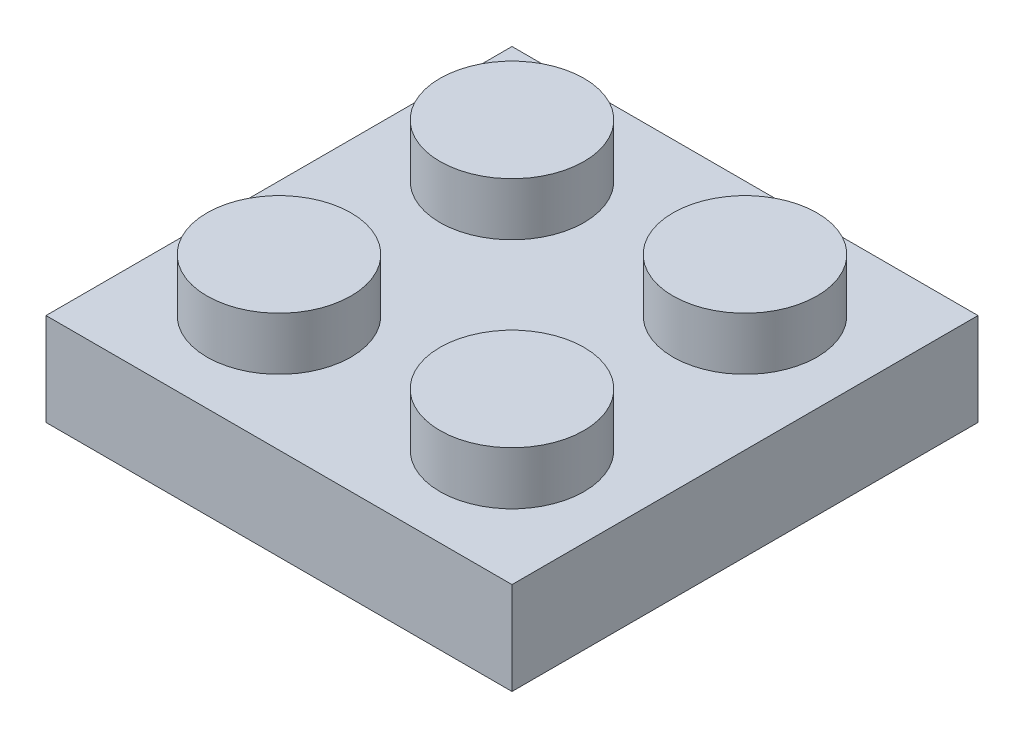
from build123d import *

# Parameters (mm, degrees)
SKETCH1_W           = 15.85
SKETCH1_H           = 15.85
BOSS_EXTRUDE1_DEPTH = 3.15
SKETCH2_R           = 2.45
BOSS_EXTRUDE2_DEPTH = 1.8
SHELL1_T            = -1.5
SKETCH3_R           = 3.25
SKETCH3_R_2         = 2.45
BOSS_EXTRUDE3_DEPTH = 1.45


with BuildPart() as part:
    # Sketch1 → Boss-Extrude1 (new body)
    with BuildSketch(Plane(origin=(0, 0, 0), x_dir=(1, 0, 0), z_dir=(0, 1, 0))):
        Rectangle(SKETCH1_W, SKETCH1_H)
    extrude(amount=-BOSS_EXTRUDE1_DEPTH)

    # Sketch2 → Boss-Extrude2 (add)
    with BuildSketch(Plane(origin=(0, 0, 0), x_dir=(1, 0, 0), z_dir=(0, 1, 0))):
        with Locations(Location((-3.9625, 3.9625, 0), (0, 0, 270))):
            Circle(SKETCH2_R)
        with Locations(Location((-3.9625, -3.9625, 0), (0, 0, 270))):
            Circle(SKETCH2_R)
        with Locations(Location((3.9625, 3.9625, 0), (0, 0, 270))):
            Circle(SKETCH2_R)
        with Locations(Location((3.9625, -3.9625, 0), (0, 0, 270))):
            Circle(SKETCH2_R)
    extrude(amount=BOSS_EXTRUDE2_DEPTH)

    # Shell1
    shell1_openings = [part.faces().sort_by_distance(p)[0] for p in [
        (0, -3.15, 0),
    ]]
    offset(amount=SHELL1_T, openings=shell1_openings, kind=Kind.INTERSECTION)

    # Sketch3 → Boss-Extrude3 (add)
    with BuildSketch(Plane.XZ.offset(1.5)):
        with Locations(Location((0, 0, 0), (0, 0, 90))):
            Circle(SKETCH3_R)
        with Locations(Location((0, 0, 0), (0, 0, 90))):
            Circle(SKETCH3_R_2, mode=Mode.SUBTRACT)
    extrude(amount=BOSS_EXTRUDE3_DEPTH)


solid = part.part
